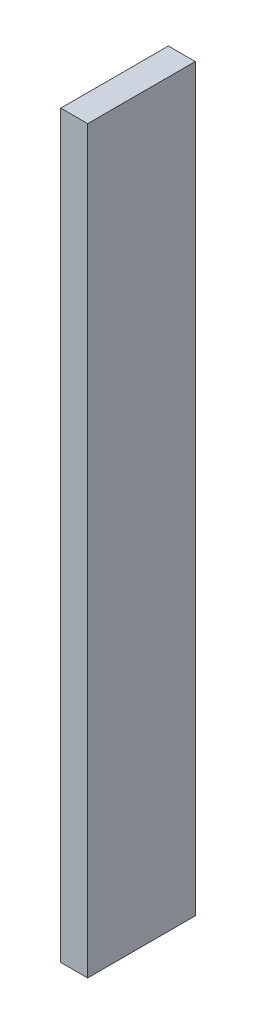
from build123d import *

# Parameters (mm, degrees)
SKETCH_1_W      = 32
SKETCH_1_H      = 220
EXTRUDE_1_DEPTH = 8


with BuildPart() as part:
    # 草图1 → 凸台-拉伸1 (new body)
    with BuildSketch(Plane(origin=(0, 0, 0), x_dir=(0, 0, -1), z_dir=(1, 0, 0))):
        with Locations((0, 110)):
            Rectangle(SKETCH_1_W, SKETCH_1_H)
    extrude(amount=EXTRUDE_1_DEPTH)


solid = part.part
